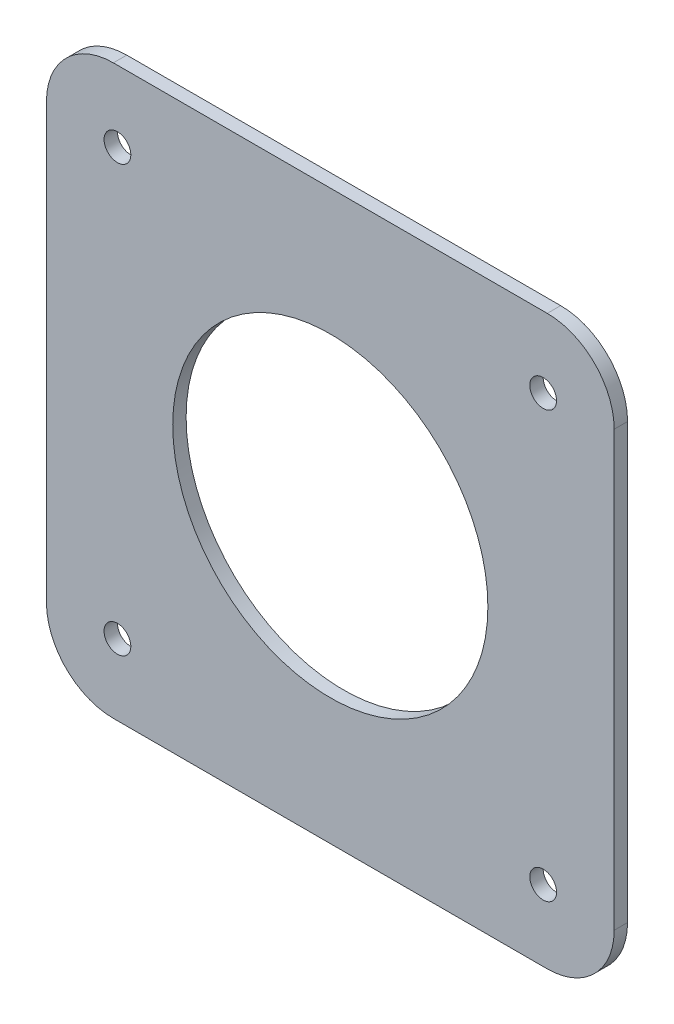
from build123d import *

# Parameters (mm, degrees)
SKETCH1_R           = 23.55
SKETCH1_R_2         = 2
BOSS_EXTRUDE1_DEPTH = 2


with BuildPart() as part:
    # Sketch1 → Boss-Extrude1 (new body)
    with BuildSketch(Plane.XY):
        with BuildLine():
            Line((-5.535475367, 65.430655792), (59.314524633, 65.430655792))
            ThreePointArc((59.314524633, 65.430655792), (66.385592445, 62.501723604), (69.314524633, 55.430655792))
            Line((69.314524633, 55.430655792), (69.314524633, -9.419344208))
            ThreePointArc((69.314524633, -9.419344208), (66.385592445, -16.49041202), (59.314524633, -19.419344208))
            Line((59.314524633, -19.419344208), (-5.535475367, -19.419344208))
            ThreePointArc((-5.535475367, -19.419344208), (-12.606543178, -16.49041202), (-15.535475367, -9.419344208))
            Line((-15.535475367, -9.419344208), (-15.535475367, 55.430655792))
            ThreePointArc((-15.535475367, 55.430655792), (-12.606543178, 62.501723604), (-5.535475367, 65.430655792))
        make_face()
        with Locations((26.889524633, 23.005655792)):
            Circle(SKETCH1_R, mode=Mode.SUBTRACT)
        with Locations((-4.925475367, 54.820655792)):
            Circle(SKETCH1_R_2, mode=Mode.SUBTRACT)
        with Locations((-4.925475367, -8.809344208)):
            Circle(SKETCH1_R_2, mode=Mode.SUBTRACT)
        with Locations((58.704524633, 54.820655792)):
            Circle(SKETCH1_R_2, mode=Mode.SUBTRACT)
        with Locations((58.704524633, -8.809344208)):
            Circle(SKETCH1_R_2, mode=Mode.SUBTRACT)
    extrude(amount=BOSS_EXTRUDE1_DEPTH)


solid = part.part
